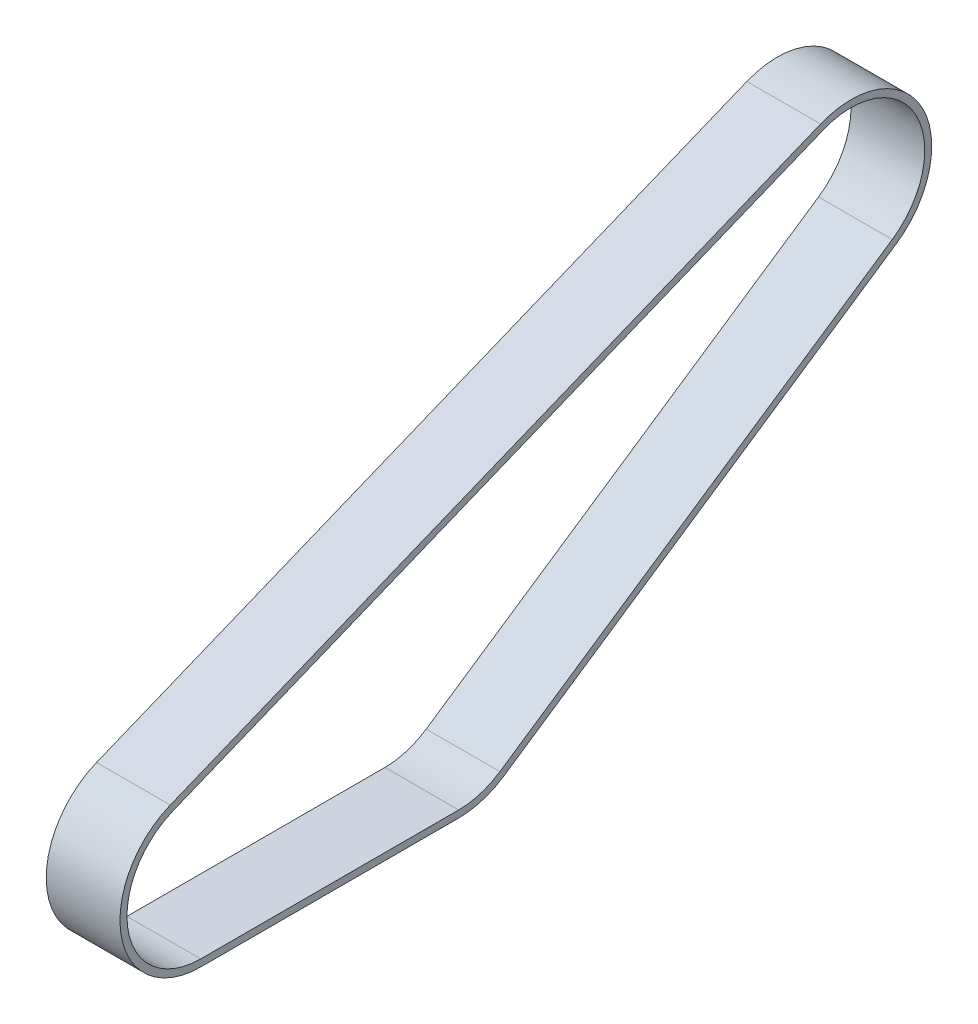
from build123d import *

# Parameters (mm, degrees)
EXTRUDE_1_DEPTH = 50


with BuildPart() as part:
    # 스케치1 → 보스-돌출1 (new body)
    with BuildSketch(Plane(origin=(0, 0, 0), x_dir=(0, 0, -1), z_dir=(1, 0, 0))):
        with BuildLine():
            Line((-68.041278197, 50.714063441), (373.078721803, 230.214063441))
            ThreePointArc((373.078721803, 230.214063441), (442.026414912, 205.264519299), (424.332130863, 134.108518499))
            Line((424.332130863, 134.108518499), (158.212130863, -45.391481501))
            ThreePointArc((158.212130863, -45.391481501), (143.603146836, -52.359602267), (127.595225221, -54.752))
            Line((127.595225221, -54.752), (-47.404774779, -54.752))
            ThreePointArc((-47.404774779, -54.752), (-101.137808871, -10.513921782), (-68.041278197, 50.714063441))
        make_face()
        with BuildLine():
            Line((-66.250208204, 46.312521406), (374.869791796, 225.812521406))
            ThreePointArc((374.869791796, 225.812521406), (437.833421534, 203.028381884), (421.674848287, 138.048106461))
            Line((421.674848287, 138.048106461), (155.554848287, -41.451893539))
            ThreePointArc((155.554848287, -41.451893539), (142.213797707, -47.815241696), (127.595225221, -50))
            Line((127.595225221, -50), (-47.404774779, -50))
            ThreePointArc((-47.404774779, -50), (-96.474246298, -9.601404316), (-66.250208204, 46.312521406))
        make_face(mode=Mode.SUBTRACT)
    extrude(amount=EXTRUDE_1_DEPTH)


solid = part.part
